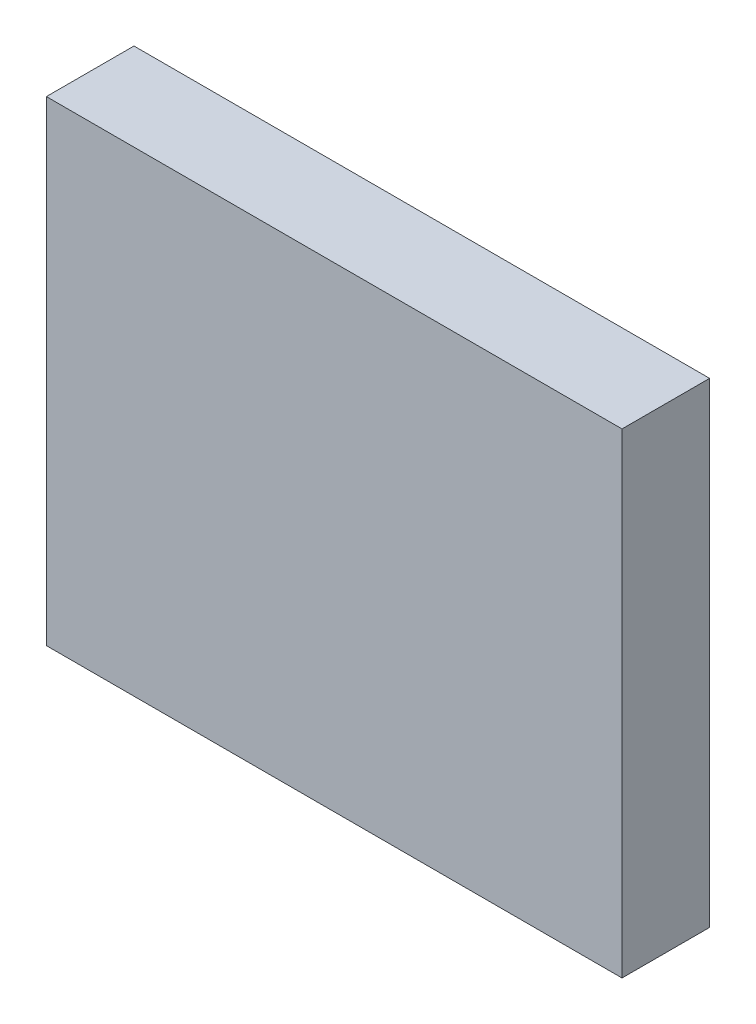
from build123d import *

# Parameters (mm, degrees)
SKETCH1_W           = 23
SKETCH1_H           = 19
BOSS_EXTRUDE1_DEPTH = 1.75


with BuildPart() as part:
    # Sketch1 → Boss-Extrude1 (new, symmetric)
    with BuildSketch(Plane.XY):
        Rectangle(SKETCH1_W, SKETCH1_H)
    extrude(amount=BOSS_EXTRUDE1_DEPTH, both=True)


solid = part.part
